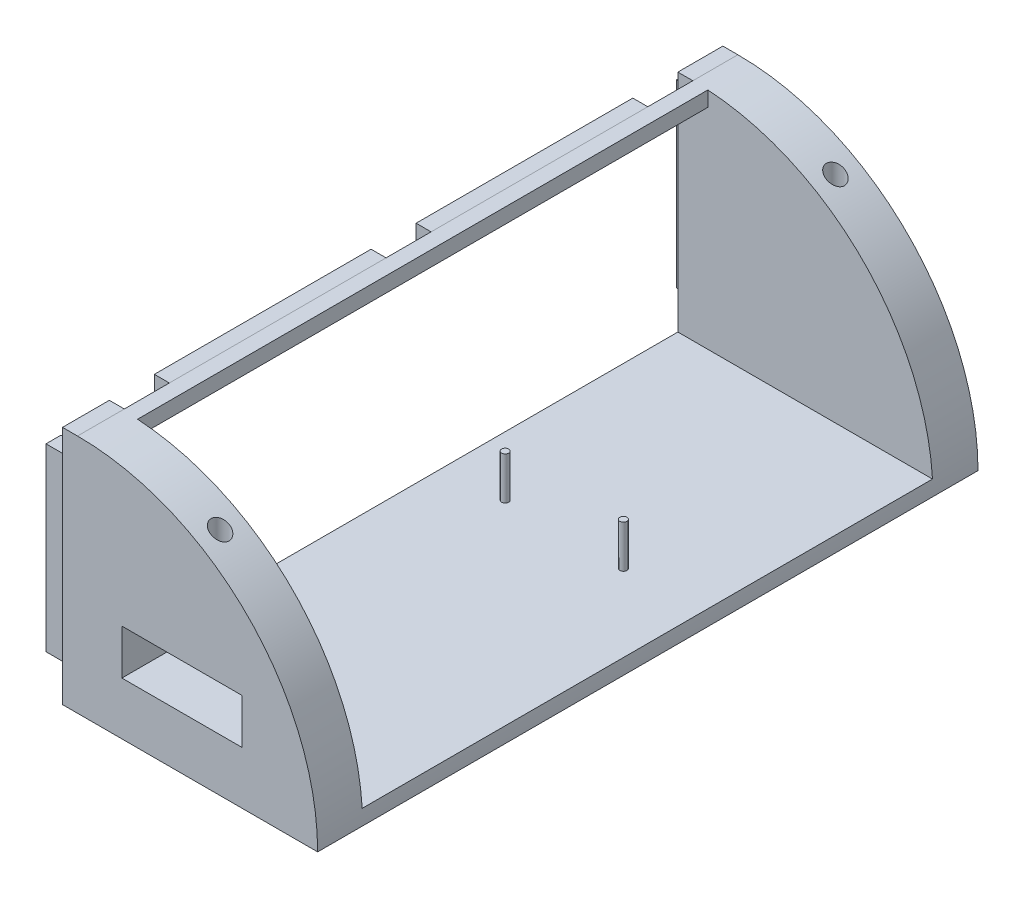
from build123d import *

# Parameters (mm, degrees)
BOSS_EXTRUDE1_DEPTH = 139.7
SHELL1_T            = -3.175
BOSS_EXTRUDE2_START = -9.525
BOSS_EXTRUDE2_DEPTH = 9.525
BOSS_EXTRUDE3_DEPTH = 9.525
SKETCH5_W           = 139.7
SKETCH5_H           = 50.8
SKETCH5_W_2         = 120.65
SKETCH5_H_2         = 44.45
BOSS_EXTRUDE4_DEPTH = 3.175
SKETCH6_W           = 3.175
SKETCH6_H           = 38.1
BOSS_EXTRUDE5_DEPTH = 5.08
CUT_EXTRUDE1_REACH  = 159.09
SKETCH7_W           = 3.175
SKETCH7_H           = 9.525
SKETCH9_W           = 47.625
SKETCH9_H           = 120.65
CUT_EXTRUDE2_DEPTH  = 157.092506627
SKETCH8_R           = 0.75
BOSS_EXTRUDE6_DEPTH = 9
SKETCH10_W          = 25.4
SKETCH10_H          = 9.525
CUT_EXTRUDE3_DEPTH  = 149.683592319
SKETCH11_R          = 1.905
CUT_EXTRUDE4_DEPTH  = 25.4


with BuildPart() as part:
    # Sketch1 → Boss-Extrude1 (new body)
    with BuildSketch(Plane.XY):
        with BuildLine():
            Line((0, 0), (0, 50.8))
            ThreePointArc((0, 50.8), (35.921024484, 35.921024484), (50.8, 0))
            Line((50.8, 0), (0, 0))
        make_face()
    extrude(amount=BOSS_EXTRUDE1_DEPTH)

    # Shell1
    shell1_openings = [part.faces().sort_by_distance(p)[0] for p in [
        (0, 25.4, 69.85),
    ]]
    offset(amount=SHELL1_T, openings=shell1_openings, kind=Kind.INTERSECTION)

    # Sketch3 → Boss-Extrude2 (add)
    with BuildSketch(Plane.XY.offset(139.7).offset(BOSS_EXTRUDE2_START)):
        with BuildLine():
            Line((0, 50.8), (0, 0))
            Line((0, 0), (50.8, 0))
            ThreePointArc((50.8, 0), (35.921024484, 35.921024484), (0, 50.8))
        make_face()
    extrude(amount=BOSS_EXTRUDE2_DEPTH)

    # Sketch4 → Boss-Extrude3 (add)
    with BuildSketch(Plane(origin=(0, 0, 0), x_dir=(-1, 0, 0), z_dir=(0, 0, -1))):
        with BuildLine():
            Line((-50.8, 0), (0, 0))
            Line((0, 0), (0, 50.8))
            ThreePointArc((0, 50.8), (-35.921024484, 35.921024484), (-50.8, 0))
        make_face()
    extrude(amount=-BOSS_EXTRUDE3_DEPTH)

    # Sketch5 → Boss-Extrude4 (add)
    with BuildSketch(Plane.ZY):
        with Locations((69.85, 25.4)):
            Rectangle(SKETCH5_W, SKETCH5_H)
        with Locations((69.85, 25.4)):
            Rectangle(SKETCH5_W_2, SKETCH5_H_2, mode=Mode.SUBTRACT)
    extrude(amount=BOSS_EXTRUDE4_DEPTH)

    # Sketch6 → Boss-Extrude5 (add)
    with BuildSketch(Plane.ZY.offset(3.175)):
        with Locations((3.175, 25.4)):
            Rectangle(SKETCH6_W, SKETCH6_H)
        with Locations((136.525, 25.4)):
            Rectangle(SKETCH6_W, SKETCH6_H)
    extrude(amount=BOSS_EXTRUDE5_DEPTH)

    # Cut-Extrude1: up to this face of the body (flat: up to its plane)
    cut_extrude1_end = Plane(part.part.faces().sort_by_distance((-1.5875, 47.625, 69.85))[0])
    # Sketch7 → Cut-Extrude1 (cut, up to the picked face)
    with BuildSketch(Plane(origin=(0, 50.8, 0), x_dir=(1, 0, 0), z_dir=(0, 1, 0)), mode=Mode.PRIVATE) as cut_extrude1_sk1:
        with Locations((-1.5875, -14.2875)):
            Rectangle(SKETCH7_W, SKETCH7_H)
    cut_extrude1_tool1 = split(extrude(cut_extrude1_sk1.sketch, amount=-CUT_EXTRUDE1_REACH, mode=Mode.PRIVATE), bisect_by=cut_extrude1_end, keep=Keep.BOTH, mode=Mode.PRIVATE)
    # Sketch7 → Cut-Extrude1 (cut, up to the picked face)
    with BuildSketch(Plane(origin=(0, 50.8, 0), x_dir=(1, 0, 0), z_dir=(0, 1, 0)), mode=Mode.PRIVATE) as cut_extrude1_sk2:
        with Locations((-1.5875, -69.6595)):
            Rectangle(SKETCH7_W, SKETCH7_H)
    cut_extrude1_tool2 = split(extrude(cut_extrude1_sk2.sketch, amount=-CUT_EXTRUDE1_REACH, mode=Mode.PRIVATE), bisect_by=cut_extrude1_end, keep=Keep.BOTH, mode=Mode.PRIVATE)
    # Sketch7 → Cut-Extrude1 (cut, up to the picked face)
    with BuildSketch(Plane(origin=(0, 50.8, 0), x_dir=(1, 0, 0), z_dir=(0, 1, 0)), mode=Mode.PRIVATE) as cut_extrude1_sk3:
        with Locations((-1.5875, -125.0315)):
            Rectangle(SKETCH7_W, SKETCH7_H)
    cut_extrude1_tool3 = split(extrude(cut_extrude1_sk3.sketch, amount=-CUT_EXTRUDE1_REACH, mode=Mode.PRIVATE), bisect_by=cut_extrude1_end, keep=Keep.BOTH, mode=Mode.PRIVATE)
    add(cut_extrude1_tool1.solids().sort_by(Axis((-1.5875, 50.8, 14.2875), (0, -1, 0)))[0], mode=Mode.SUBTRACT)
    add(cut_extrude1_tool2.solids().sort_by(Axis((-1.5875, 50.8, 69.6595), (0, -1, 0)))[0], mode=Mode.SUBTRACT)
    add(cut_extrude1_tool3.solids().sort_by(Axis((-1.5875, 50.8, 125.0315), (0, -1, 0)))[0], mode=Mode.SUBTRACT)

    # Sketch9 → Cut-Extrude2 (cut, through all)
    with BuildSketch(Plane(origin=(0, 3.175, 0), x_dir=(1, 0, 0), z_dir=(0, 1, 0))):
        with Locations((26.9875, -69.85)):
            Rectangle(SKETCH9_W, SKETCH9_H)
    extrude(amount=CUT_EXTRUDE2_DEPTH, mode=Mode.SUBTRACT)

    # Sketch8 → Boss-Extrude6 (add)
    with BuildSketch(Plane(origin=(0, 3.175, 0), x_dir=(1, 0, 0), z_dir=(0, 1, 0))):
        with Locations(Location((34.373685984, -124.592684636, 0), (0, 0, 270))):
            Circle(SKETCH8_R)
        with Locations(Location((34.373685984, -58.592684636, 0), (0, 0, 270))):
            Circle(SKETCH8_R)
        with Locations(Location((9.373685984, -58.592684636, 0), (0, 0, 270))):
            Circle(SKETCH8_R)
        with Locations(Location((9.373685984, -124.592684636, 0), (0, 0, 270))):
            Circle(SKETCH8_R)
    extrude(amount=BOSS_EXTRUDE6_DEPTH)

    # Sketch10 → Cut-Extrude3 (cut, through all)
    with BuildSketch(Plane(origin=(0, 0, 130.175), x_dir=(-1, 0, 0), z_dir=(0, 0, -1))):
        with Locations((-22.088336315, 15.908721759)):
            Rectangle(SKETCH10_W, SKETCH10_H)
    extrude(amount=-CUT_EXTRUDE3_DEPTH, mode=Mode.SUBTRACT)

    # Sketch11 → Cut-Extrude4 (cut)
    with BuildSketch(Plane(origin=(0, 50.8, 0), x_dir=(1, 0, 0), z_dir=(0, 1, 0))):
        with Locations(Location((25.4, -4.7625, 0), (0, 0, 270))):
            Circle(SKETCH11_R)
        with Locations(Location((25.4, -134.9375, 0), (0, 0, 270))):
            Circle(SKETCH11_R)
    extrude(amount=-CUT_EXTRUDE4_DEPTH, mode=Mode.SUBTRACT)


solid = part.part
